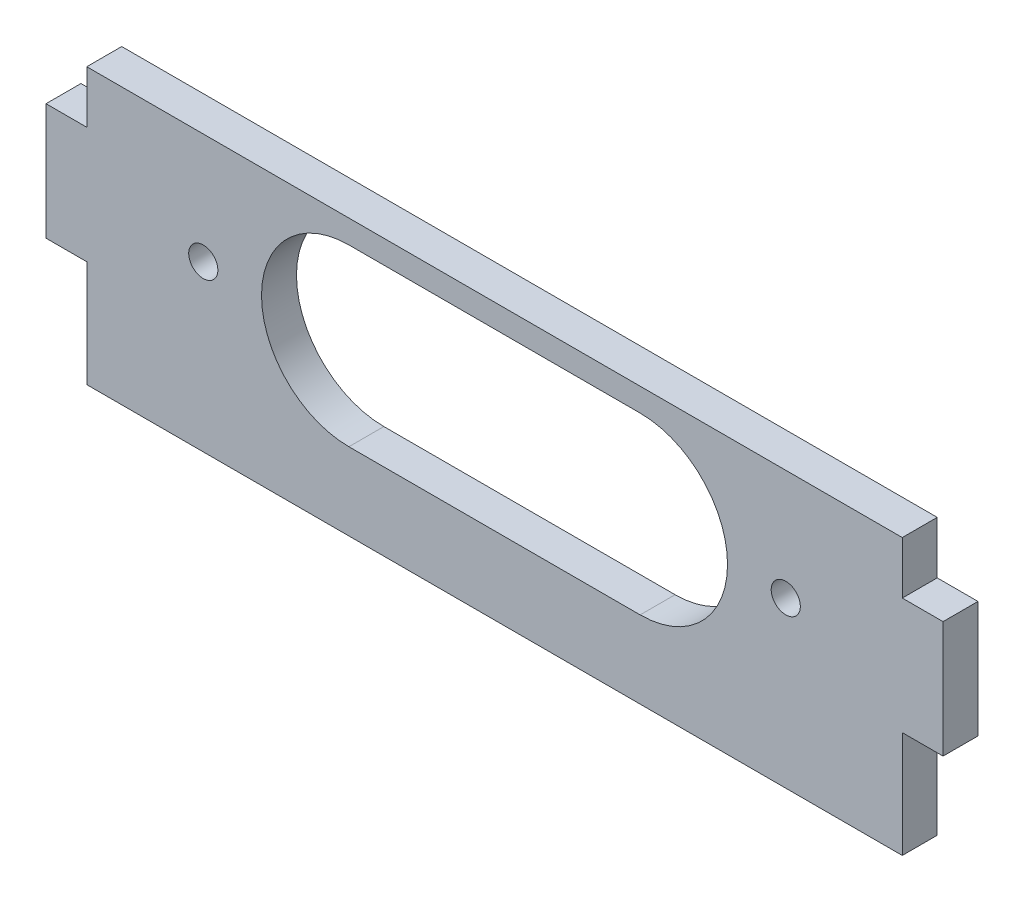
from build123d import *

# Parameters (mm, degrees)
SKETCH1_R           = 2.5
BOSS_EXTRUDE1_DEPTH = 6


with BuildPart() as part:
    # Sketch1 → Boss-Extrude1 (new body)
    with BuildSketch(Plane.XY):
        Polygon((140, 0), (0, 0), (0, -9), (-7, -9), (-7, -29), (0, -29), (0, -47.27), (140, -47.27), (140, -29), (147, -29), (147, -9), (140, -9), align=None)
        with Locations((120, -19)):
            Circle(SKETCH1_R, mode=Mode.SUBTRACT)
        with Locations((20, -19)):
            Circle(SKETCH1_R, mode=Mode.SUBTRACT)
        with BuildLine():
            Line((45, -34), (95, -34))
            ThreePointArc((95, -34), (110, -19), (95, -4))
            Line((95, -4), (45, -4))
            ThreePointArc((45, -4), (30, -19), (45, -34))
        make_face(mode=Mode.SUBTRACT)
    extrude(amount=BOSS_EXTRUDE1_DEPTH)


solid = part.part
